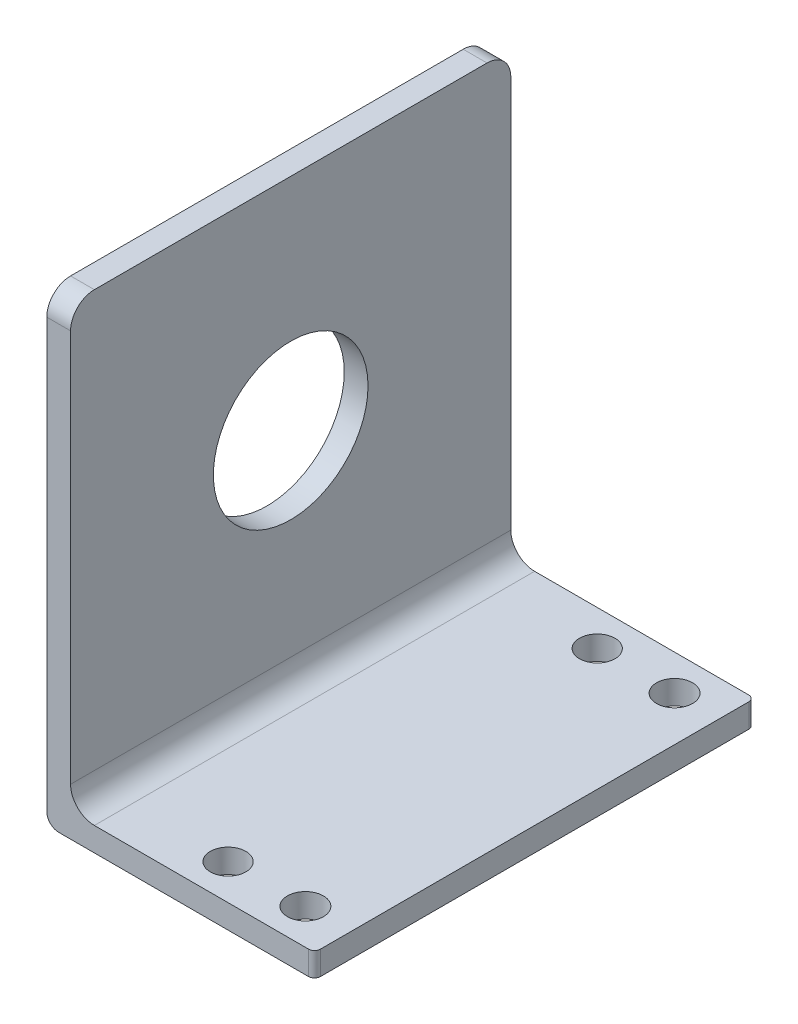
from build123d import *

# Parameters (mm, degrees)
BOSS_EXTRUDE1_DEPTH = 37
SKETCH2_R           = 6.5
SKETCH2_R_2         = 1.5
CUT_EXTRUDE1_DEPTH  = 10
SKETCH3_R           = 1.513801081
SKETCH3_R_2         = 1.495226131
CUT_EXTRUDE2_DEPTH  = 10
FILLET1_R           = 2
FILLET3_R           = 0.5
SKETCH5_W           = 7.144886566
SKETCH5_H           = 37
BOSS_EXTRUDE3_DEPTH = 2
SKETCH6_R           = 2.342689667
BOSS_EXTRUDE4_DEPTH = 2
FILLET5_R           = 2


with BuildPart() as part:
    # Sketch1 → Boss-Extrude1 (new body)
    with BuildSketch(Plane.XY):
        with BuildLine():
            Line((0, 0), (0, 37))
            Line((0, 37), (-2, 37))
            Line((-2, 37), (-2, -1))
            ThreePointArc((-2, -1), (-1.707106781, -1.707106781), (-1, -2))
            Line((-1, -2), (20.5, -2))
            Line((20.5, -2), (20.5, 0))
            Line((20.5, 0), (0, 0))
        make_face()
    extrude(amount=BOSS_EXTRUDE1_DEPTH)

    # Sketch2 → Cut-Extrude1 (cut)
    with BuildSketch(Plane(origin=(0, 0, 0), x_dir=(0, 0, -1), z_dir=(1, 0, 0))):
        with Locations((-18.5, 18.5)):
            Circle(SKETCH2_R)
        with Locations((-18.5, 9)):
            Circle(SKETCH2_R_2)
    extrude(amount=-CUT_EXTRUDE1_DEPTH, mode=Mode.SUBTRACT)

    # Sketch3 → Cut-Extrude2 (cut)
    with BuildSketch(Plane(origin=(0, 0, 0), x_dir=(1, 0, 0), z_dir=(0, 1, 0))):
        with Locations(Location((16.75, -2.987028894, 0), (0, 0, 270))):
            Circle(SKETCH3_R)
        with Locations(Location((10.25, -2.987028894, 0), (0, 0, 270))):
            Circle(SKETCH3_R_2)
        with Locations(Location((4, -2.987028894, 0), (0, 0, 270))):
            Circle(SKETCH3_R_2)
        with Locations(Location((16.75, -34.012971106, 0), (0, 0, 270))):
            Circle(SKETCH3_R)
        with Locations(Location((10.25, -34.012971106, 0), (0, 0, 270))):
            Circle(SKETCH3_R_2)
        with Locations(Location((4, -34.012971106, 0), (0, 0, 270))):
            Circle(SKETCH3_R_2)
    extrude(amount=-CUT_EXTRUDE2_DEPTH, mode=Mode.SUBTRACT)

    # Fillet1
    fillet1_edges = [part.edges().sort_by_distance(p)[0] for p in [
        (-1, 37, 37),
        (-1, 37, 0),
    ]]
    fillet(fillet1_edges, radius=FILLET1_R)

    # Fillet3
    fillet3_edges = [part.edges().sort_by_distance(p)[0] for p in [
        (20.5, -1, 37),
        (20.5, -1, 0),
    ]]
    fillet(fillet3_edges, radius=FILLET3_R)

    # Sketch5 → Boss-Extrude3 (add)
    with BuildSketch(Plane(origin=(0, 0, 0), x_dir=(1, 0, 0), z_dir=(0, 1, 0))):
        with Locations((3.572443283, -18.5)):
            Rectangle(SKETCH5_W, SKETCH5_H)
    extrude(amount=-BOSS_EXTRUDE3_DEPTH)

    # Sketch6 → Boss-Extrude4 (add)
    with BuildSketch(Plane(origin=(0, 0, 0), x_dir=(0, 0, -1), z_dir=(1, 0, 0))):
        with Locations((-18.5, 9)):
            Circle(SKETCH6_R)
    extrude(amount=-BOSS_EXTRUDE4_DEPTH)

    # Fillet5
    fillet5_edges = [part.edges().sort_by_distance(p)[0] for p in [
        (0, 0, 18.5),
    ]]
    fillet(fillet5_edges, radius=FILLET5_R)


solid = part.part
